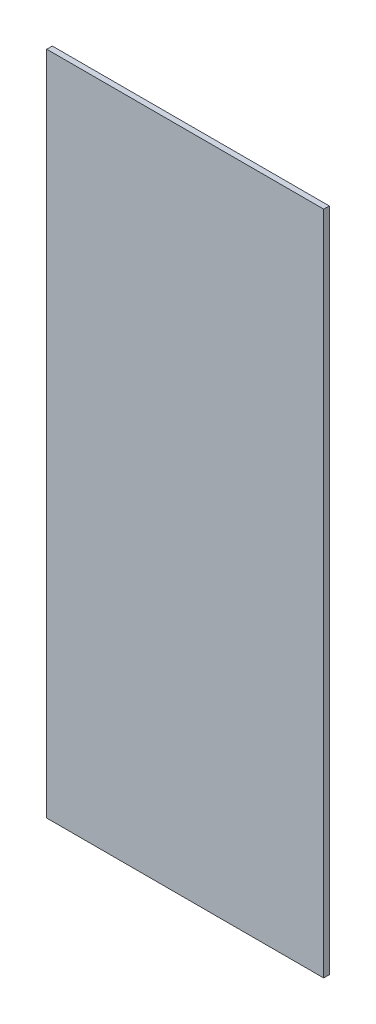
from build123d import *

# Parameters (mm, degrees)
SKETCH1_W           = 78.887500086
SKETCH1_H           = 189.656
BOSS_EXTRUDE1_DEPTH = 1.5875


with BuildPart() as part:
    # Sketch1 → Boss-Extrude1 (new body)
    with BuildSketch(Plane.XY):
        with Locations((-114.891302504, 109.368458108)):
            Rectangle(SKETCH1_W, SKETCH1_H)
    extrude(amount=BOSS_EXTRUDE1_DEPTH)


solid = part.part
